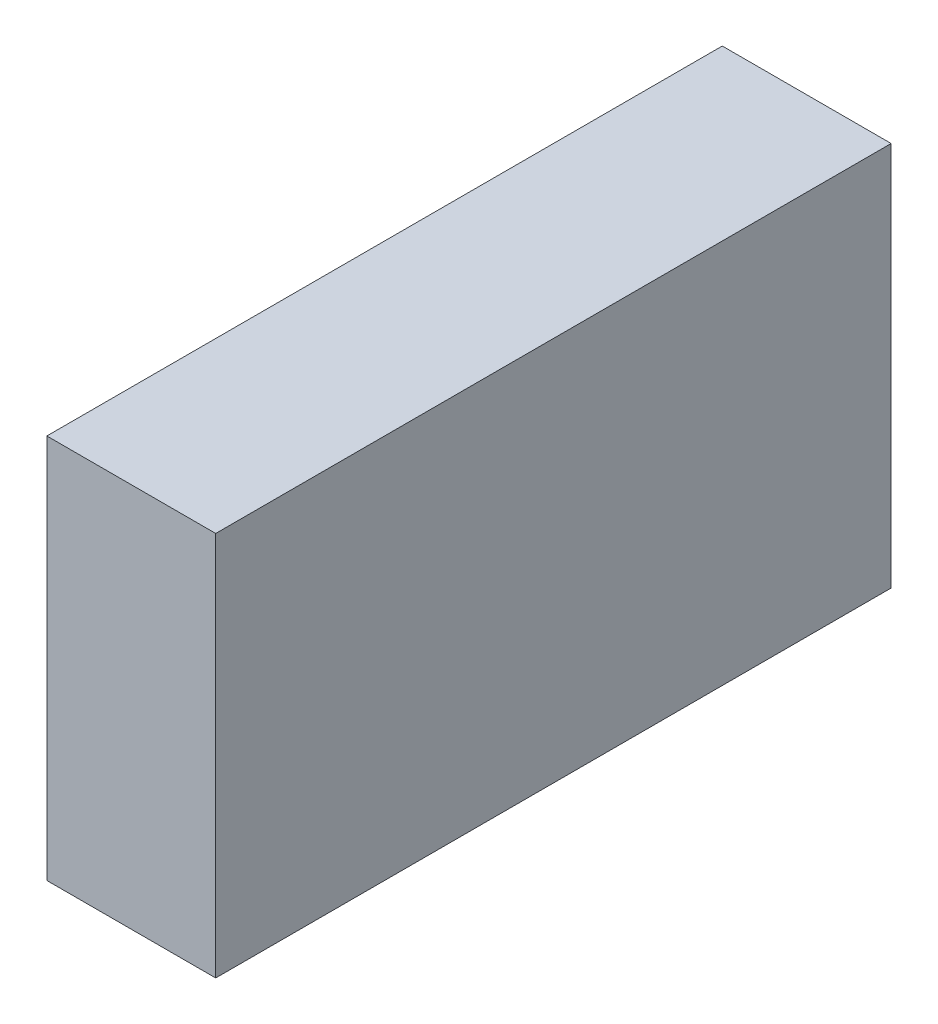
from build123d import *

# Parameters (mm, degrees)
ESBO_O1_W                = 50
ESBO_O1_H                = 114
RESSALTO_EXTRUS_O1_DEPTH = 200


with BuildPart() as part:
    # Esboço1 → Ressalto-extrusão1 (new body)
    with BuildSketch(Plane.XY):
        with Locations((25, 57)):
            Rectangle(ESBO_O1_W, ESBO_O1_H)
    extrude(amount=RESSALTO_EXTRUS_O1_DEPTH)


solid = part.part
